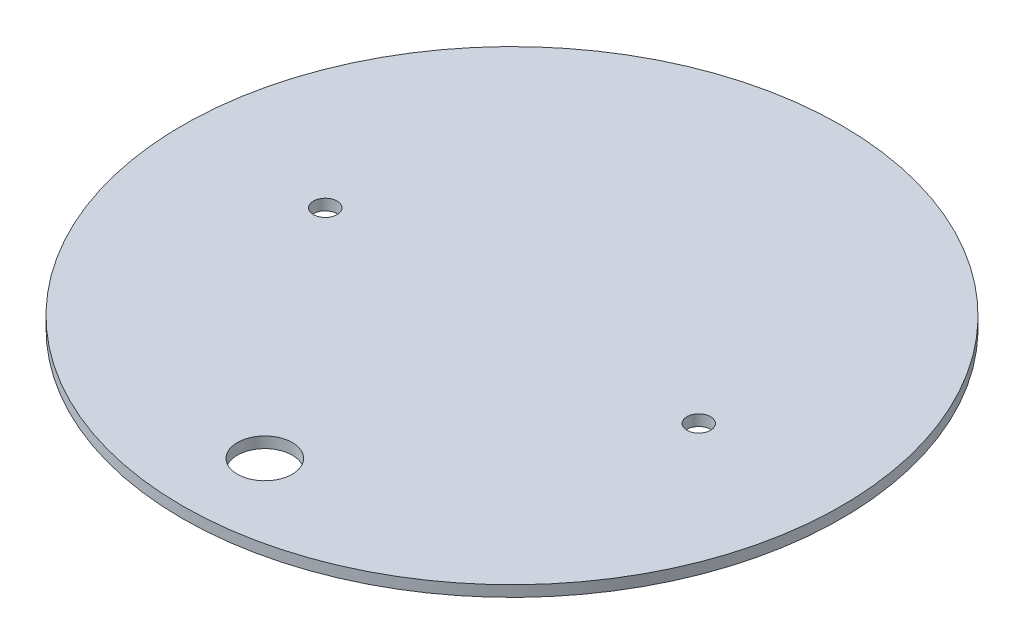
from build123d import *

# Parameters (mm, degrees)
SKETCH1_R           = 60
SKETCH1_R_2         = 2.15
SKETCH1_R_3         = 5
BOSS_EXTRUDE1_DEPTH = 2


with BuildPart() as part:
    # Sketch1 → Boss-Extrude1 (new body)
    with BuildSketch(Plane(origin=(0, 0, 0), x_dir=(1, 0, 0), z_dir=(0, 1, 0))):
        with Locations(Location((0, 0, 0), (0, 0, 270))):
            Circle(SKETCH1_R)
        with Locations(Location((-34, 0, 0), (0, 0, 270))):
            Circle(SKETCH1_R_2, mode=Mode.SUBTRACT)
        with Locations(Location((34, 0, 0), (0, 0, 270))):
            Circle(SKETCH1_R_2, mode=Mode.SUBTRACT)
        with Locations(Location((0, -45, 0), (0, 0, 270))):
            Circle(SKETCH1_R_3, mode=Mode.SUBTRACT)
    extrude(amount=BOSS_EXTRUDE1_DEPTH)


solid = part.part
